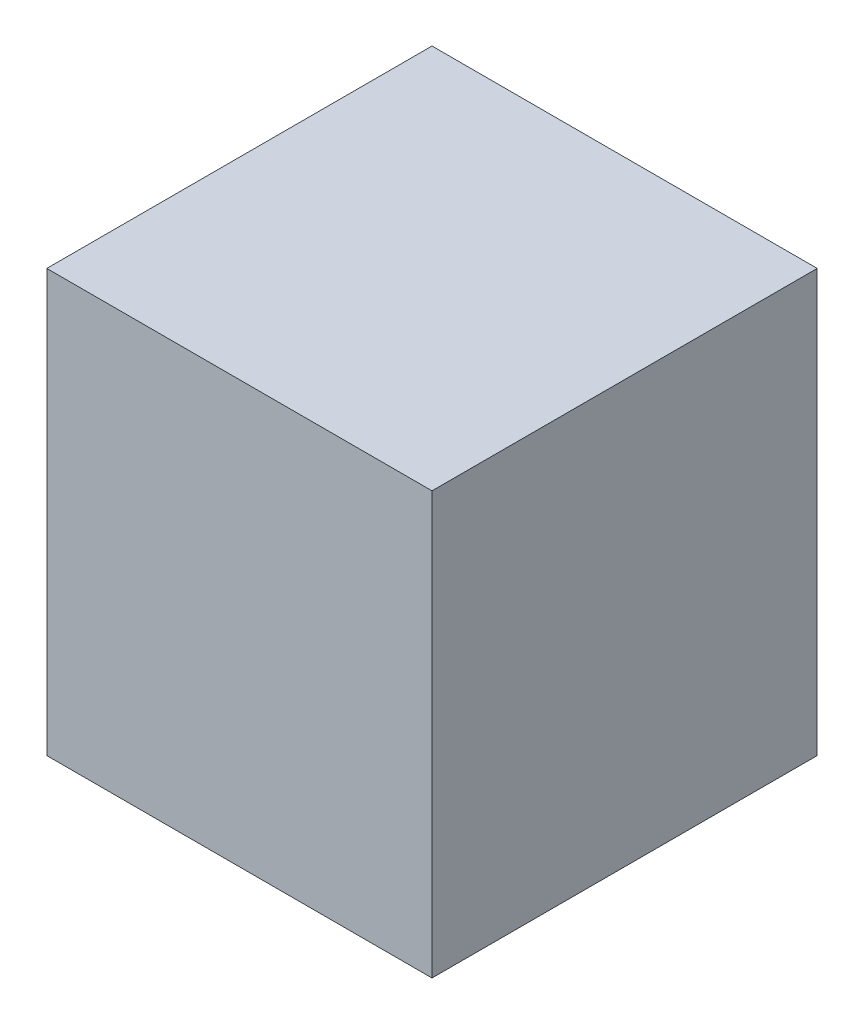
from build123d import *

# Parameters (mm, degrees)
SKETCH1_W           = 42
SKETCH1_H           = 42
BOSS_EXTRUDE1_DEPTH = 46


with BuildPart() as part:
    # Sketch1 → Boss-Extrude1 (new body)
    with BuildSketch(Plane(origin=(0, 0, 0), x_dir=(1, 0, 0), z_dir=(0, 1, 0))):
        with Locations((21, 21)):
            Rectangle(SKETCH1_W, SKETCH1_H)
    extrude(amount=BOSS_EXTRUDE1_DEPTH)


solid = part.part
